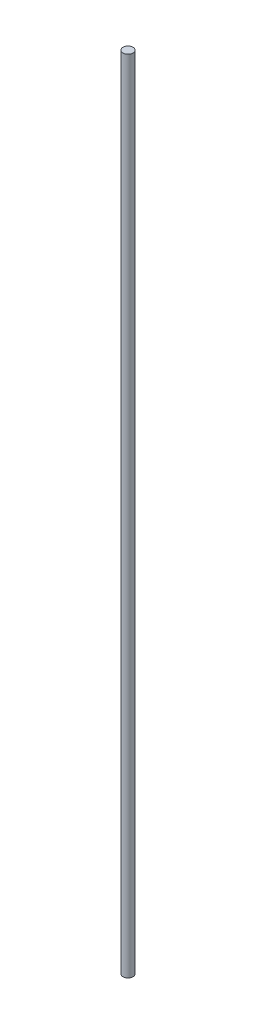
from build123d import *

# Parameters (mm, degrees)
SKETCH1_R           = 4
BOSS_EXTRUDE1_DEPTH = 635


with BuildPart() as part:
    # Sketch1 → Boss-Extrude1 (new body)
    with BuildSketch(Plane(origin=(0, 0, 0), x_dir=(1, 0, 0), z_dir=(0, 1, 0))):
        with Locations(Location((0, 0, 0), (0, 0, 90))):
            Circle(SKETCH1_R)
    extrude(amount=BOSS_EXTRUDE1_DEPTH)


solid = part.part
